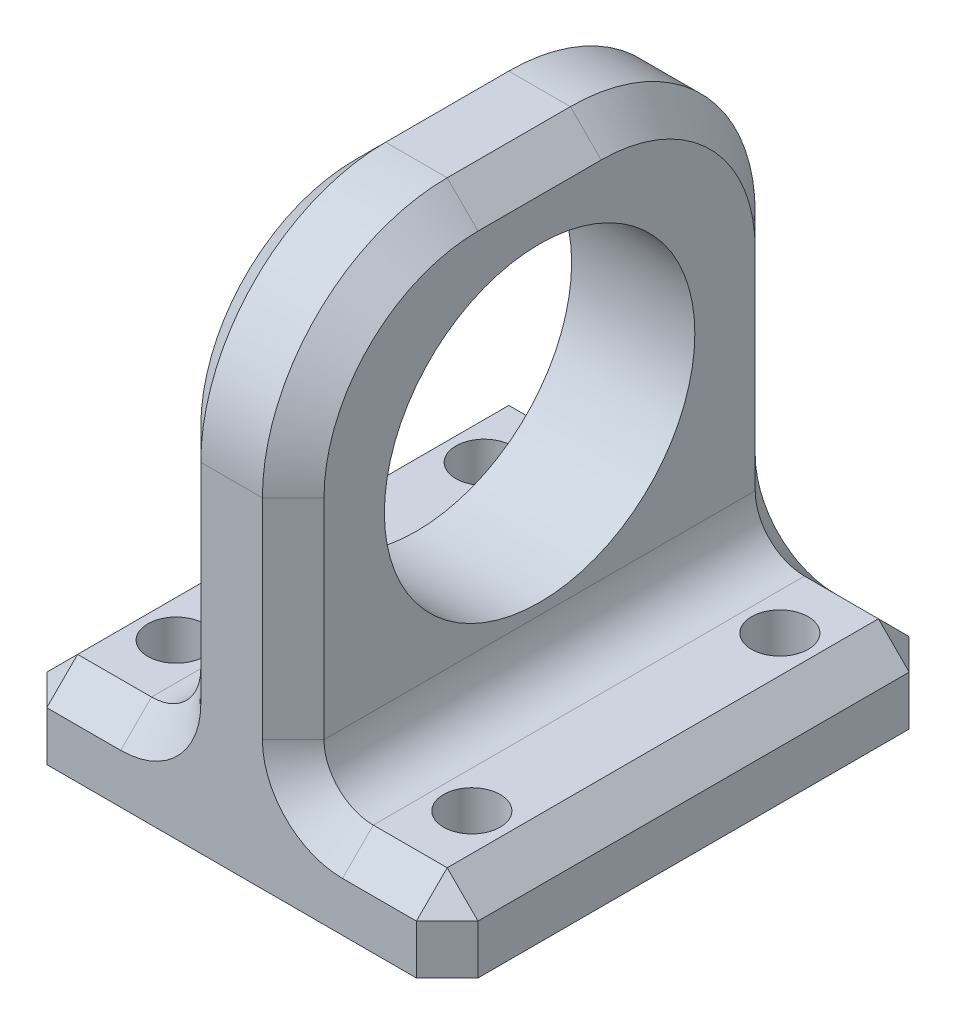
from build123d import *

# Parameters (mm, degrees)
SKETCH1_R                = 16.002
BOSS_EXTRUDE1_DEPTH      = 6.35
SKETCH2_W                = 50.8
SKETCH2_H                = 8.255
BOSS_EXTRUDE2_DEPTH      = 15.875
FILLET1_R                = 5.08
CHAMFER1_SIZE            = 3.175
SKETCH3_R                = 2.921
CUT_EXTRUDE1_DEPTH       = 72.867301501
FILLET1_OF_MIRROR2_R     = 5.08
CHAMFER1_OF_MIRROR2_SIZE = 3.175


with BuildPart() as part:
    # Sketch1 → Boss-Extrude1 (new body)
    with BuildSketch(Plane(origin=(0, 0, 0), x_dir=(0, 0, -1), z_dir=(1, 0, 0))):
        with BuildLine():
            Line((0, 0), (50.8, 0))
            Line((50.8, 0), (50.8, 34.925))
            ThreePointArc((50.8, 34.925), (45.220384182, 48.395384182), (31.75, 53.975))
            Line((31.75, 53.975), (19.05, 53.975))
            ThreePointArc((19.05, 53.975), (5.579615818, 48.395384182), (0, 34.925))
            Line((0, 34.925), (0, 0))
        make_face()
        with Locations((25.4, 30.48)):
            Circle(SKETCH1_R, mode=Mode.SUBTRACT)
    boss_extrude1 = extrude(amount=BOSS_EXTRUDE1_DEPTH)

    # Sketch2 → Boss-Extrude2 (add)
    with BuildSketch(Plane(origin=(6.35, 0, 0), x_dir=(0, 0, -1), z_dir=(1, 0, 0))):
        with Locations((25.4, 4.1275)):
            Rectangle(SKETCH2_W, SKETCH2_H)
    boss_extrude2 = extrude(amount=BOSS_EXTRUDE2_DEPTH)

    # Fillet1
    fillet1_edges = [part.edges().sort_by_distance(p)[0] for p in [
        (6.35, 8.255, -25.4),
    ]]
    fillet(fillet1_edges, radius=FILLET1_R)

    # Chamfer1
    chamfer1_edges = [part.edges().sort_by_distance(p)[0] for p in [
        (22.225, 4.1275, 0),
        (22.225, 8.255, -25.4),
        (16.8275, 8.255, 0),
        (7.837897552, 9.742897552, 0),
        (6.35, 24.13, 0),
        (6.35, 48.395384182, -5.579615818),
        (6.35, 53.975, -25.4),
        (6.35, 48.395384182, -45.220384182),
        (6.35, 24.13, -50.8),
        (7.837897552, 9.742897552, -50.8),
        (16.8275, 8.255, -50.8),
        (22.225, 4.1275, -50.8),
    ]]
    chamfer(chamfer1_edges, length=CHAMFER1_SIZE)

    # Sketch3 → Cut-Extrude1 (cut, through all)
    with BuildSketch(Plane(origin=(0, 8.255, 0), x_dir=(1, 0, 0), z_dir=(0, 1, 0))):
        with Locations((15.24, 9.525)):
            Circle(SKETCH3_R)
        with Locations((15.24, 41.275)):
            Circle(SKETCH3_R)
    cut_extrude1 = extrude(amount=-CUT_EXTRUDE1_DEPTH, mode=Mode.SUBTRACT)

    # Mirror2: Boss-Extrude1, Boss-Extrude2, Cut-Extrude1 across plane
    add(boss_extrude1.mirror(Plane(origin=(0, 34.925, -19.05), x_dir=(0, 0, 1), z_dir=(1, 0, 0))))
    add(boss_extrude2.mirror(Plane(origin=(0, 34.925, -19.05), x_dir=(0, 0, 1), z_dir=(1, 0, 0))))
    add(cut_extrude1.mirror(Plane(origin=(0, 34.925, -19.05), x_dir=(0, 0, 1), z_dir=(1, 0, 0))), mode=Mode.SUBTRACT)

    # Fillet1 of Mirror2
    fillet1_of_mirror2_edges = [part.edges().sort_by_distance(p)[0] for p in [
        (-6.35, 8.255, -25.4),
    ]]
    fillet(fillet1_of_mirror2_edges, radius=FILLET1_OF_MIRROR2_R)

    # Chamfer1 of Mirror2
    chamfer1_of_mirror2_edges = [part.edges().sort_by_distance(p)[0] for p in [
        (-22.225, 4.1275, 0),
        (-22.225, 8.255, -25.4),
        (-16.8275, 8.255, 0),
        (-7.837897552, 9.742897552, 0),
        (-6.35, 24.13, 0),
        (-6.35, 48.395384182, -5.579615818),
        (-6.35, 53.975, -25.4),
        (-6.35, 48.395384182, -45.220384182),
        (-6.35, 24.13, -50.8),
        (-7.837897552, 9.742897552, -50.8),
        (-16.8275, 8.255, -50.8),
        (-22.225, 4.1275, -50.8),
    ]]
    chamfer(chamfer1_of_mirror2_edges, length=CHAMFER1_OF_MIRROR2_SIZE)


solid = part.part
